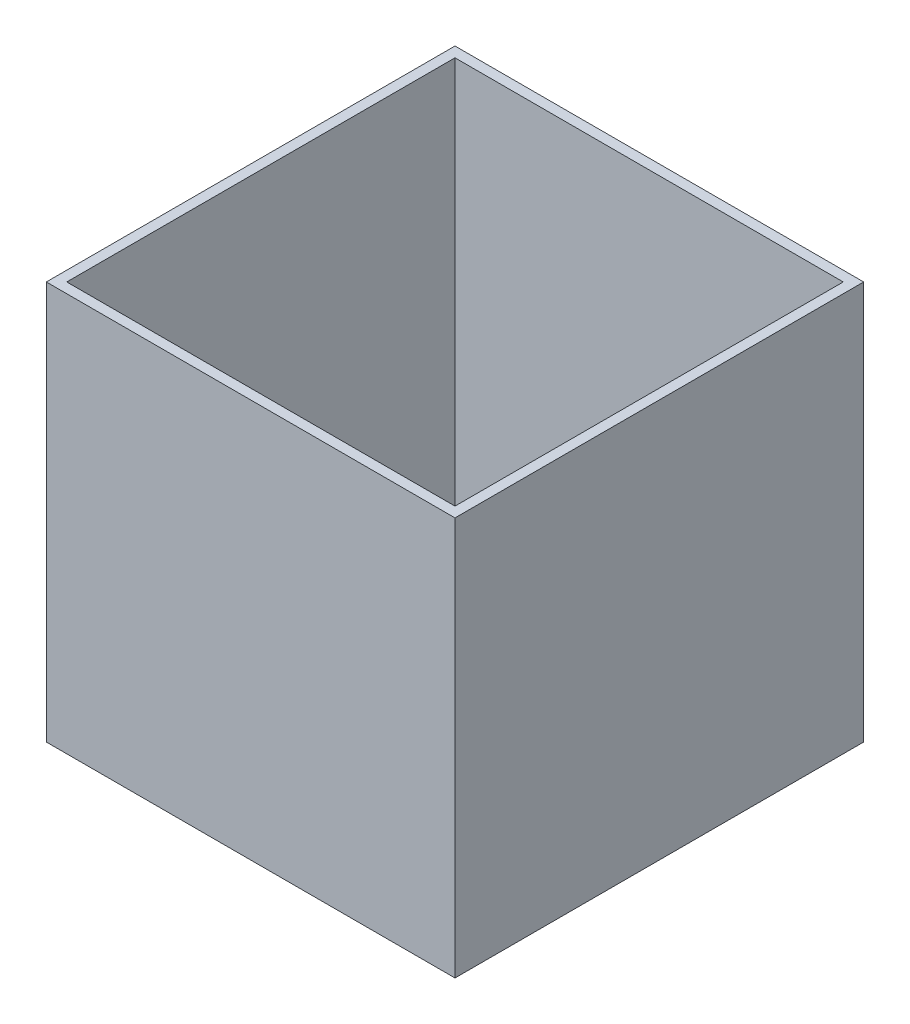
from build123d import *

# Parameters (mm, degrees)
SKETCH1_W               = 80
SKETCH1_H               = 80
SKETCH1_R               = 18.4
BOSS_EXTRUDE1_DEPTH     = 2
SKETCH2_W               = 4
SKETCH2_H               = 18.5
BOSS_EXTRUDE2_DEPTH     = 15.25
SKETCH3_R               = 2.2
CUT_EXTRUDE1_DEPTH      = 94.976393312
MIRROR2_COPY_1_SKETCH_W = 4
MIRROR2_COPY_1_SKETCH_H = 18.5
MIRROR2_COPY_1_DEPTH    = 15.25
MIRROR2_COPY_2_SKETCH_R = 2.2
MIRROR2_COPY_2_DEPTH    = 94.976393312
SKETCH4_R               = 2.2
CUT_EXTRUDE2_DEPTH      = 62.388618652
SKETCH5_W               = 4
SKETCH5_H               = 15.25
CUT_EXTRUDE3_DEPTH      = 93.258129723
SKETCH6_W               = 80
SKETCH6_H               = 80
SKETCH6_W_2             = 76
SKETCH6_H_2             = 76
BOSS_EXTRUDE3_DEPTH     = 76


with BuildPart() as part:
    # Sketch1 → Boss-Extrude1 (new body)
    with BuildSketch(Plane(origin=(0, 0, 0), x_dir=(1, 0, 0), z_dir=(0, 1, 0))):
        Rectangle(SKETCH1_W, SKETCH1_H)
        with Locations(Location((0, 0, 0), (0, 0, 270))):
            Circle(SKETCH1_R, mode=Mode.SUBTRACT)
    extrude(amount=BOSS_EXTRUDE1_DEPTH)

    # Sketch2 → Boss-Extrude2 (add)
    with BuildSketch(Plane(origin=(0, 2, 0), x_dir=(1, 0, 0), z_dir=(0, 1, 0))):
        with Locations((42, -30.75)):
            Rectangle(SKETCH2_W, SKETCH2_H)
    boss_extrude2 = extrude(amount=-BOSS_EXTRUDE2_DEPTH)

    # Sketch3 → Cut-Extrude1 (cut, through all)
    with BuildSketch(Plane(origin=(44, 0, 0), x_dir=(0, 0, -1), z_dir=(1, 0, 0))):
        with Locations((-30.75, -8.125)):
            Circle(SKETCH3_R)
    cut_extrude1 = extrude(amount=-CUT_EXTRUDE1_DEPTH, mode=Mode.SUBTRACT)

    # Mirror1: Boss-Extrude2, Cut-Extrude1 across plane
    add(boss_extrude2.mirror(Plane(origin=(0, 0, 0), x_dir=(0, 0, 1), z_dir=(1, 0, 0))))
    add(cut_extrude1.mirror(Plane(origin=(0, 0, 0), x_dir=(0, 0, 1), z_dir=(1, 0, 0))), mode=Mode.SUBTRACT)

    # Mirror2: Boss-Extrude2, Cut-Extrude1 across plane
    add(boss_extrude2.mirror(Plane(origin=(0, 0, 0), x_dir=(1, 0, 0), z_dir=(0, 0, -1))))
    add(cut_extrude1.mirror(Plane(origin=(0, 0, 0), x_dir=(1, 0, 0), z_dir=(0, 0, -1))), mode=Mode.SUBTRACT)

    # Mirror2 copy 1 sketch → Mirror2 copy 1 (add)
    with BuildSketch(Plane(origin=(0, 2, 0), x_dir=(-1, 0, 0), z_dir=(0, 1, 0))):
        with Locations((42, -30.75)):
            Rectangle(MIRROR2_COPY_1_SKETCH_W, MIRROR2_COPY_1_SKETCH_H)
    extrude(amount=-MIRROR2_COPY_1_DEPTH)

    # Mirror2 copy 2 sketch → Mirror2 copy 2 (cut, through all)
    with BuildSketch(Plane.ZY.offset(44)):
        with Locations((-30.75, -8.125)):
            Circle(MIRROR2_COPY_2_SKETCH_R)
    extrude(amount=-MIRROR2_COPY_2_DEPTH, mode=Mode.SUBTRACT)

    # Sketch4 → Cut-Extrude2 (cut, through all)
    with BuildSketch(Plane(origin=(0, 2, 0), x_dir=(1, 0, 0), z_dir=(0, 1, 0))):
        with Locations(Location((-24, 24, 0), (0, 0, 270))):
            Circle(SKETCH4_R)
        with Locations(Location((24, 24, 0), (0, 0, 270))):
            Circle(SKETCH4_R)
    cut_extrude2 = extrude(amount=-CUT_EXTRUDE2_DEPTH, mode=Mode.SUBTRACT)

    # Mirror3: Cut-Extrude2 across plane
    add(cut_extrude2.mirror(Plane(origin=(0, 0, 0), x_dir=(1, 0, 0), z_dir=(0, 0, -1))), mode=Mode.SUBTRACT)

    # Sketch5 → Cut-Extrude3 (cut, through all)
    with BuildSketch(Plane.XY.offset(40)):
        with Locations((-42, -5.625)):
            Rectangle(SKETCH5_W, SKETCH5_H)
        with Locations((42, -5.625)):
            Rectangle(SKETCH5_W, SKETCH5_H)
    extrude(amount=-CUT_EXTRUDE3_DEPTH, mode=Mode.SUBTRACT)

    # Sketch6 → Boss-Extrude3 (add)
    with BuildSketch(Plane(origin=(0, 2, 0), x_dir=(1, 0, 0), z_dir=(0, 1, 0))):
        Rectangle(SKETCH6_W, SKETCH6_H)
        Rectangle(SKETCH6_W_2, SKETCH6_H_2, mode=Mode.SUBTRACT)
    extrude(amount=BOSS_EXTRUDE3_DEPTH)


solid = part.part
